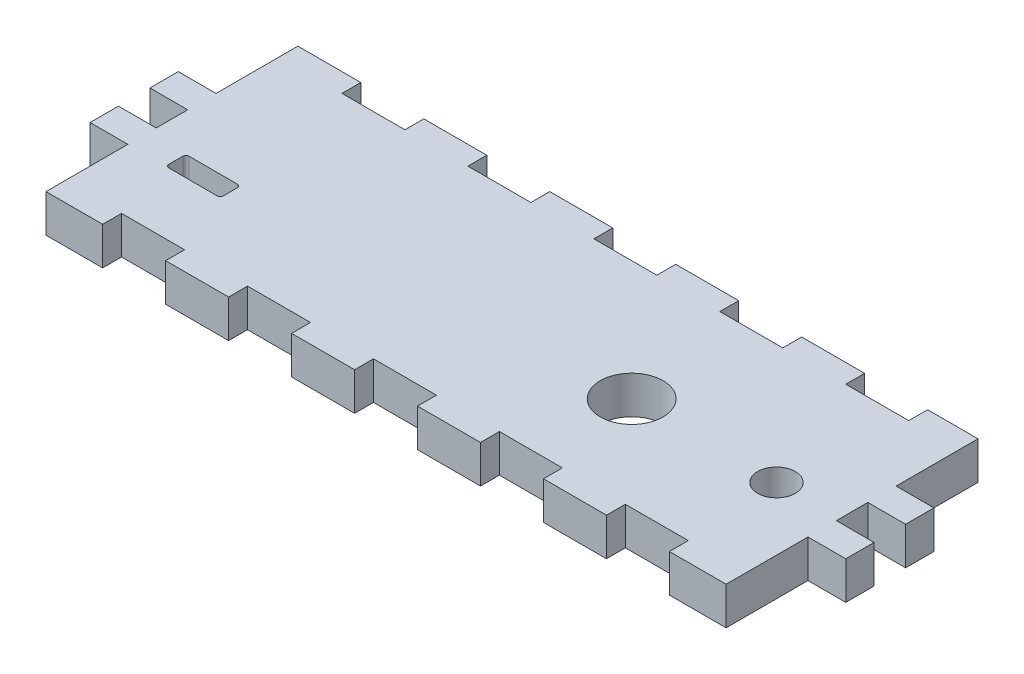
from build123d import *

# Parameters (mm, degrees)
SKETCH_1_W          = 112
SKETCH_1_H          = 40
EXTRUDE_1_DEPTH     = 6
SKETCH_2_R          = 3
CUT_EXTRUDE_1_DEPTH = 120.079805173
CUT_EXTRUDE_2_DEPTH = 10
SKETCH_4_R          = 4.9895
CUT_EXTRUDE_3_DEPTH = 120.079805173
SKETCH_6_W          = 4.5
SKETCH_6_H          = 6
EXTRUDE_3_DEPTH     = 6
SKETCH_11_W         = 40
SKETCH_11_H         = 6
CUT_EXTRUDE_4_DEPTH = 4
SKETCH_12_W         = 4.5
SKETCH_12_H         = 6
EXTRUDE_10_DEPTH    = 6
SKETCH_13_W         = 9
SKETCH_13_H         = 6
SKETCH_13_W_2       = 10
EXTRUDE_11_DEPTH    = 3
SKETCH_14_W         = 108
SKETCH_14_H         = 6
CUT_EXTRUDE_5_DEPTH = 2
SKETCH_15_W         = 108
SKETCH_15_H         = 6
CUT_EXTRUDE_6_DEPTH = 2
SKETCH_16_W         = 10
SKETCH_16_H         = 6
CUT_EXTRUDE_7_DEPTH = 3
SKETCH_17_W         = 10
SKETCH_17_H         = 6
SKETCH_17_W_2       = 8
EXTRUDE_12_DEPTH    = 1
SKETCH_18_W         = 10
SKETCH_18_H         = 6
EXTRUDE_13_DEPTH    = 1


with BuildPart() as part:
    # Эскиз1 → Бобышка-Вытянуть1 (new body)
    with BuildSketch(Plane(origin=(0, 0, 0), x_dir=(1, 0, 0), z_dir=(0, 1, 0))):
        with Locations((56, -20)):
            Rectangle(SKETCH_1_W, SKETCH_1_H)
    extrude(amount=EXTRUDE_1_DEPTH)

    # Эскиз2 → Вырез-Вытянуть1 (cut, through all)
    with BuildSketch(Plane(origin=(0, 6, 0), x_dir=(1, 0, 0), z_dir=(0, 1, 0))):
        with Locations(Location((102, -25, 0), (0, 0, 270))):
            Circle(SKETCH_2_R)
    extrude(amount=-CUT_EXTRUDE_1_DEPTH, mode=Mode.SUBTRACT)

    # Эскиз3 → Вырез-Вытянуть2 (cut)
    with BuildSketch(Plane(origin=(0, 6, 0), x_dir=(1, 0, 0), z_dir=(0, 1, 0))):
        with BuildLine():
            Line((10.5, -26.78), (18.17, -26.78))
            ThreePointArc((18.17, -26.78), (18.523553391, -26.926446609), (18.67, -27.28))
            Line((18.67, -27.28), (18.67, -29.5))
            ThreePointArc((18.67, -29.5), (18.523553391, -29.853553391), (18.17, -30))
            Line((18.17, -30), (10.5, -30))
            ThreePointArc((10.5, -30), (10.146446609, -29.853553391), (10, -29.5))
            Line((10, -29.5), (10, -27.28))
            ThreePointArc((10, -27.28), (10.146446609, -26.926446609), (10.5, -26.78))
        make_face()
    extrude(amount=-CUT_EXTRUDE_2_DEPTH, mode=Mode.SUBTRACT)

    # Эскиз4 → Вырез-Вытянуть3 (cut, through all)
    with BuildSketch(Plane(origin=(0, 6, 0), x_dir=(1, 0, 0), z_dir=(0, 1, 0))):
        with Locations(Location((79, -25, 0), (0, 0, 270))):
            Circle(SKETCH_4_R)
    extrude(amount=-CUT_EXTRUDE_3_DEPTH, mode=Mode.SUBTRACT)

    # Эскиз6 → Бобышка-Вытянуть3 (add)
    with BuildSketch(Plane(origin=(112, 0, 0), x_dir=(0, 0, -1), z_dir=(1, 0, 0))):
        with Locations((-27.75, 3)):
            Rectangle(SKETCH_6_W, SKETCH_6_H)
        with Locations((-18.25, 3)):
            Rectangle(SKETCH_6_W, SKETCH_6_H)
    extrude(amount=EXTRUDE_3_DEPTH)

    # Эскиз11 → Вырез-Вытянуть4 (cut)
    with BuildSketch(Plane.ZY):
        with Locations((20, 3)):
            Rectangle(SKETCH_11_W, SKETCH_11_H)
    extrude(amount=-CUT_EXTRUDE_4_DEPTH, mode=Mode.SUBTRACT)

    # Эскиз12 → Бобышка-Вытянуть10 (add)
    with BuildSketch(Plane.ZY.offset(-4)):
        with Locations((18.25, 3)):
            Rectangle(SKETCH_12_W, SKETCH_12_H)
        with Locations((27.75, 3)):
            Rectangle(SKETCH_12_W, SKETCH_12_H)
    extrude(amount=EXTRUDE_10_DEPTH)

    # Эскиз13 → Бобышка-Вытянуть11 (add)
    with BuildSketch(Plane.XY.offset(40)):
        with Locations((8.5, 3)):
            Rectangle(SKETCH_13_W, SKETCH_13_H)
        with Locations((107.5, 3)):
            Rectangle(SKETCH_13_W, SKETCH_13_H)
        with Locations((28, 3)):
            Rectangle(SKETCH_13_W_2, SKETCH_13_H)
        with Locations((48, 3)):
            Rectangle(SKETCH_13_W_2, SKETCH_13_H)
        with Locations((68, 3)):
            Rectangle(SKETCH_13_W_2, SKETCH_13_H)
        with Locations((88, 3)):
            Rectangle(SKETCH_13_W_2, SKETCH_13_H)
    extrude(amount=EXTRUDE_11_DEPTH)

    # Эскиз14 → Вырез-Вытянуть5 (cut)
    with BuildSketch(Plane(origin=(0, 0, 0), x_dir=(-1, 0, 0), z_dir=(0, 0, -1))):
        with Locations((-58, 3)):
            Rectangle(SKETCH_14_W, SKETCH_14_H)
    extrude(amount=-CUT_EXTRUDE_5_DEPTH, mode=Mode.SUBTRACT)

    # Эскиз15 → Вырез-Вытянуть6 (cut)
    with BuildSketch(Plane(origin=(0, 0, 2), x_dir=(-1, 0, 0), z_dir=(0, 0, -1))):
        with Locations((-58, 3)):
            Rectangle(SKETCH_15_W, SKETCH_15_H)
    extrude(amount=-CUT_EXTRUDE_6_DEPTH, mode=Mode.SUBTRACT)

    # Эскиз16 → Вырез-Вытянуть7 (cut)
    with BuildSketch(Plane(origin=(0, 0, 4), x_dir=(-1, 0, 0), z_dir=(0, 0, -1))):
        with Locations((-19, 3)):
            Rectangle(SKETCH_16_W, SKETCH_16_H)
        with Locations((-39, 3)):
            Rectangle(SKETCH_16_W, SKETCH_16_H)
        with Locations((-59, 3)):
            Rectangle(SKETCH_16_W, SKETCH_16_H)
        with Locations((-79, 3)):
            Rectangle(SKETCH_16_W, SKETCH_16_H)
        with Locations((-99, 3)):
            Rectangle(SKETCH_16_W, SKETCH_16_H)
    extrude(amount=-CUT_EXTRUDE_7_DEPTH, mode=Mode.SUBTRACT)

    # Эскиз17 → Бобышка-Вытянуть12 (add)
    with BuildSketch(Plane(origin=(0, 0, 4), x_dir=(-1, 0, 0), z_dir=(0, 0, -1))):
        with Locations((-9, 3)):
            Rectangle(SKETCH_17_W, SKETCH_17_H)
        with Locations((-29, 3)):
            Rectangle(SKETCH_17_W, SKETCH_17_H)
        with Locations((-49, 3)):
            Rectangle(SKETCH_17_W, SKETCH_17_H)
        with Locations((-69, 3)):
            Rectangle(SKETCH_17_W, SKETCH_17_H)
        with Locations((-89, 3)):
            Rectangle(SKETCH_17_W, SKETCH_17_H)
        with Locations((-108, 3)):
            Rectangle(SKETCH_17_W_2, SKETCH_17_H)
    extrude(amount=EXTRUDE_12_DEPTH)

    # Эскиз18 → Бобышка-Вытянуть13 (add)
    with BuildSketch(Plane(origin=(0, 0, 7), x_dir=(-1, 0, 0), z_dir=(0, 0, -1))):
        with Locations((-19, 3)):
            Rectangle(SKETCH_18_W, SKETCH_18_H)
        with Locations((-39, 3)):
            Rectangle(SKETCH_18_W, SKETCH_18_H)
        with Locations((-59, 3)):
            Rectangle(SKETCH_18_W, SKETCH_18_H)
        with Locations((-79, 3)):
            Rectangle(SKETCH_18_W, SKETCH_18_H)
        with Locations((-99, 3)):
            Rectangle(SKETCH_18_W, SKETCH_18_H)
    extrude(amount=EXTRUDE_13_DEPTH)


solid = part.part
